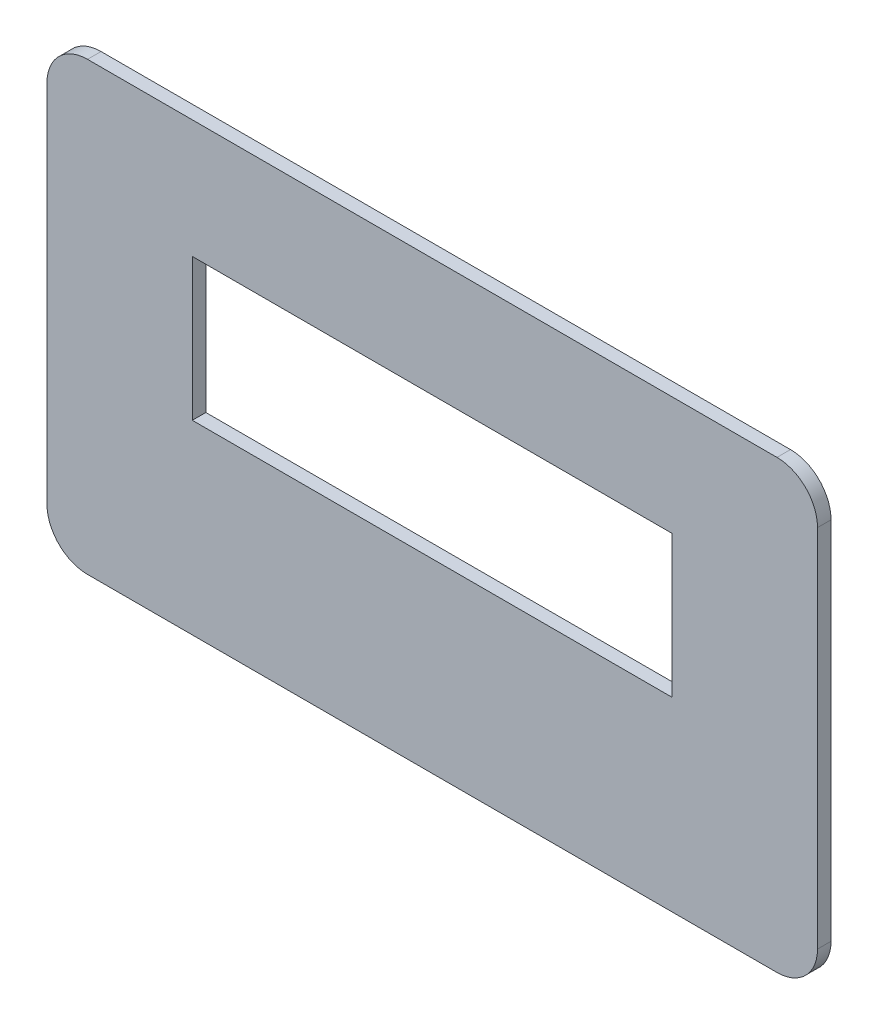
from build123d import *

# Parameters (mm, degrees)
SKETCH1_W           = 71
SKETCH1_H           = 21
BOSS_EXTRUDE1_DEPTH = 2


with BuildPart() as part:
    # Sketch1 → Boss-Extrude1 (new body)
    with BuildSketch(Plane.XY):
        with BuildLine():
            Line((51, 33), (-51, 33))
            ThreePointArc((-51, 33), (-55.242640687, 31.242640687), (-57, 27))
            Line((-57, 27), (-57, -27))
            ThreePointArc((-57, -27), (-55.242640687, -31.242640687), (-51, -33))
            Line((-51, -33), (51, -33))
            ThreePointArc((51, -33), (55.242640687, -31.242640687), (57, -27))
            Line((57, -27), (57, 27))
            ThreePointArc((57, 27), (55.242640687, 31.242640687), (51, 33))
        make_face()
        with Locations((0, 5)):
            Rectangle(SKETCH1_W, SKETCH1_H, mode=Mode.SUBTRACT)
    extrude(amount=BOSS_EXTRUDE1_DEPTH)


solid = part.part
